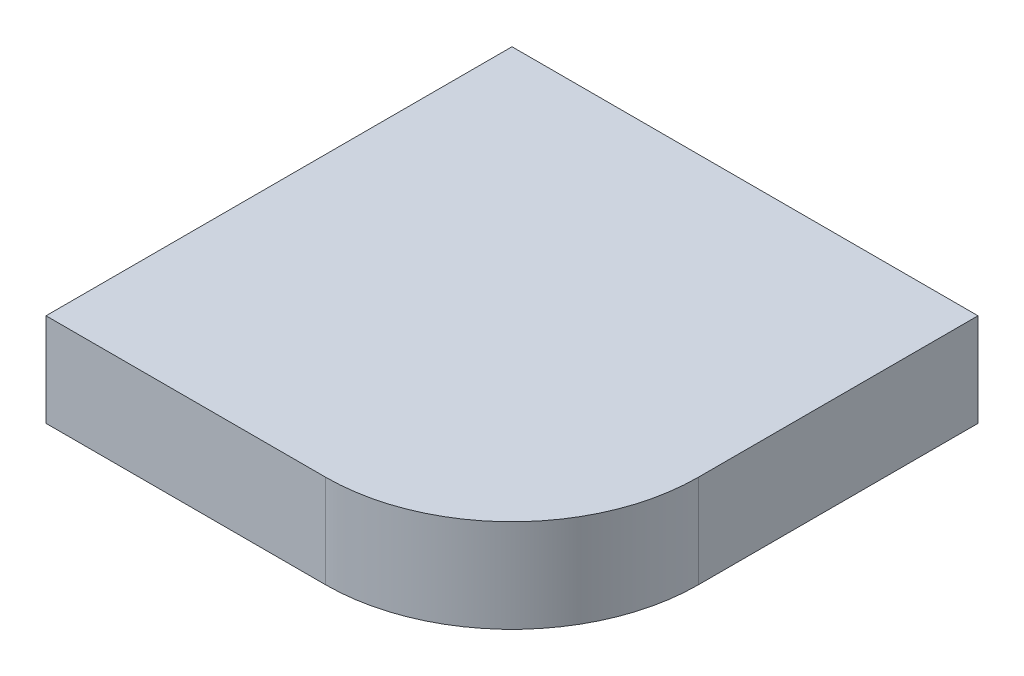
from build123d import *

# Parameters (mm, degrees)
BOSS_EXTRUDE1_DEPTH = 10


with BuildPart() as part:
    # Sketch1 → Boss-Extrude1 (new body)
    with BuildSketch(Plane(origin=(0, 0, 0), x_dir=(1, 0, 0), z_dir=(0, 1, 0))):
        with BuildLine():
            Line((0, -20), (-30, -20))
            Line((-30, -20), (-30, 30))
            Line((-30, 30), (20, 30))
            Line((20, 30), (20, 0))
            ThreePointArc((20, 0), (14.142135624, -14.142135624), (0, -20))
        make_face()
    extrude(amount=BOSS_EXTRUDE1_DEPTH)


solid = part.part
